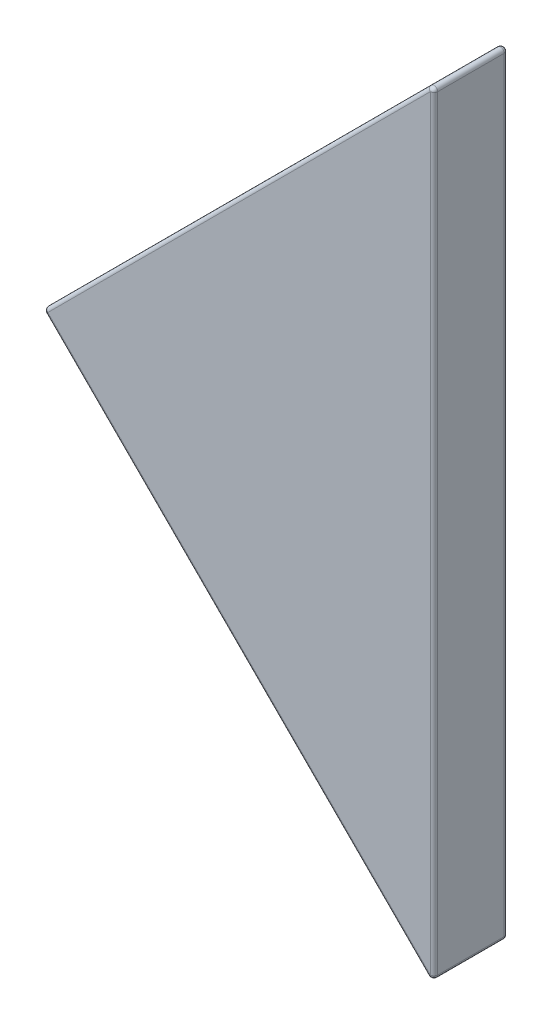
from build123d import *

# Parameters (mm, degrees)
EXTRUDE_1_DEPTH = 10
FILLET_1_R      = 0.5


with BuildPart() as part:
    # 草图1 → 凸台-拉伸1 (new body)
    with BuildSketch(Plane.XY):
        Polygon((0, 0), (0, 106.066017178), (-53.033008589, 53.033008589), align=None)
    extrude(amount=EXTRUDE_1_DEPTH)

    # 圆角1
    fillet_1_edges = [part.edges().sort_by_distance(p)[0] for p in [
        (0, 53.033008589, 10),
        (0, 53.033008589, 0),
        (-26.516504294, 79.549512883, 10),
        (-26.516504294, 26.516504294, 0),
        (-26.516504294, 79.549512883, 0),
        (0, 106.066017178, 5),
        (0, 0, 5),
        (-53.033008589, 53.033008589, 5),
        (-26.516504294, 26.516504294, 10),
    ]]
    fillet(fillet_1_edges, radius=FILLET_1_R)


solid = part.part
